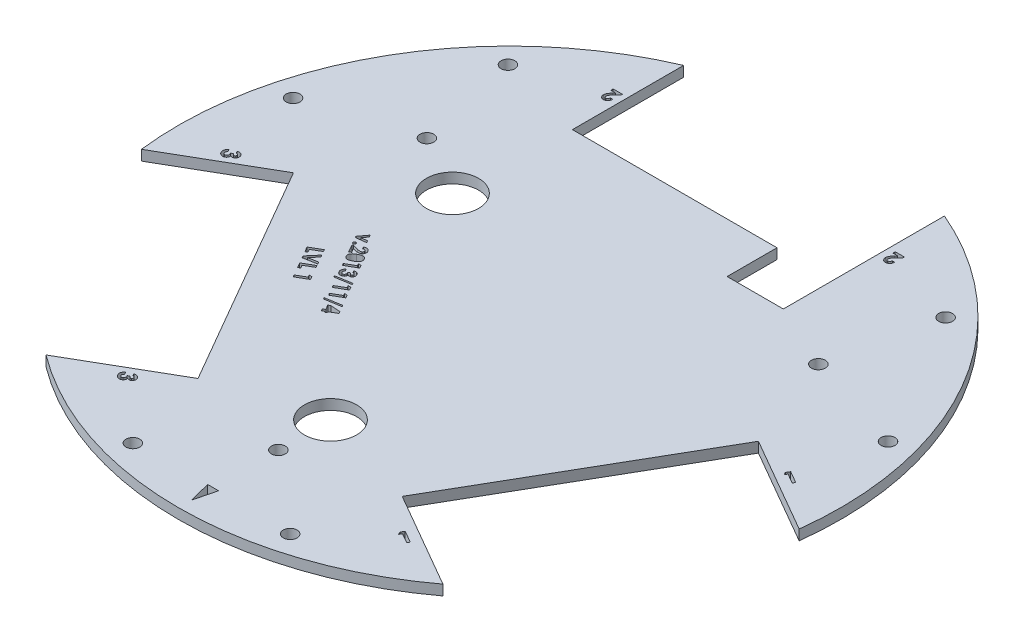
from build123d import *

# Parameters (mm, degrees)
BOSS_EXTRUDE1_DEPTH            = 2.3622
SKETCH2_R                      = 1.59
STRUCTURE_MOUNTING_HOLES_DEPTH = 10
SKETCH4_R                      = 6
SKETCH4_R_2                    = 5.999999938
CABLE_HOLES_DEPTH              = 10
SKETCH8_W                      = 12.929724252
SKETCH8_H                      = 12.570939697
CUT_EXTRUDE6_DEPTH             = 2.54
CUT_EXTRUDE7_DEPTH             = 10


with BuildPart() as part:
    # Sketch1 → Boss-Extrude1 (new body)
    with BuildSketch(Plane(origin=(0, 0, 0), x_dir=(1, 0, 0), z_dir=(0, 1, 0))):
        with BuildLine():
            Line((-30, 70.045984896), (-30, 44.445984896))
            Line((-30, 44.445984896), (30, 44.445984896))
            Line((30, 44.445984896), (30, 70.045984896))
            ThreePointArc((30, 70.045984896), (65.991135768, 38.1), (75.661602353, -9.042230334))
            Line((75.661602353, -9.042230334), (53.491352016, 3.757769666))
            Line((53.491352016, 3.757769666), (23.491352016, -48.203754561))
            Line((23.491352016, -48.203754561), (45.661602353, -61.003754561))
            ThreePointArc((45.661602353, -61.003754561), (0, -76.2), (-45.661602353, -61.003754561))
            Line((-45.661602353, -61.003754561), (-23.491352016, -48.203754561))
            Line((-23.491352016, -48.203754561), (-53.491352016, 3.757769666))
            Line((-53.491352016, 3.757769666), (-75.661602353, -9.042230333))
            ThreePointArc((-75.661602353, -9.042230333), (-65.991135768, 38.1), (-30, 70.045984896))
        make_face()
        Polygon((30.339963763, -55.594499543), (30.792172296, -54.811561842), (33.540404468, -56.399061842), (33.240204147, -56.918688245), (30.982977585, -55.614852107), (30.656064524, -56.180907796), align=None, mode=Mode.SUBTRACT)
        Polygon((62.802624019, 0.63247737), (63.254832553, 1.415415071), (66.003064724, -0.172084929), (65.702864404, -0.691711332), (63.445637841, 0.612124806), (63.11872478, 0.046069117), align=None, mode=Mode.SUBTRACT)
        with BuildLine():
            Line((32.930769231, 55.129318229), (33.500641026, 55.129318229))
            add(Edge.make_bspline(
                [(33.500641026, 55.129318229), (33.498180803, 55.086209991), (33.493373676, 55.001979084), (33.474231165, 54.879638558), (33.448646767, 54.764011929), (33.414209536, 54.655446816), (33.371792359, 54.553897607), (33.320339524, 54.459700679), (33.261387227, 54.372181067), (33.193747175, 54.292873689), (33.12016455, 54.221573945), (33.040827993, 54.159241837), (32.95596287, 54.10706171), (32.866136655, 54.064258115), (32.771702175, 54.030009725), (32.671705302, 54.00712396), (32.567028379, 53.991622143), (32.495367913, 53.990265891), (32.458844151, 53.989574639)],
                knots=[0, 0, 0, 0, 1.198928049, 2.342633425, 3.435730849, 4.486331048, 5.502589352, 6.488331875, 7.46361919, 8.428949135, 9.378681775, 10.305958057, 11.226249248, 12.140413166, 13.066341608, 14.010670971, 14.986082777, 16, 16, 16, 16], degree=3))
            add(Edge.make_bspline(
                [(32.458844151, 53.989574639), (32.413992606, 53.990881783), (32.326393407, 53.993434754), (32.199511317, 54.018015164), (32.080257487, 54.055878636), (31.96981038, 54.110337114), (31.868748868, 54.179322953), (31.778274355, 54.262459761), (31.697971611, 54.358727753), (31.630487936, 54.467423303), (31.575599258, 54.582922009), (31.535968383, 54.701653921), (31.510227483, 54.821225079), (31.507463063, 54.901709624), (31.506089744, 54.941693029)],
                knots=[0, 0, 0, 0, 1.075206757, 2.099977874, 3.089436832, 4.070080219, 5.043757236, 6.01602434, 7.009399377, 8.042659726, 9.078134622, 10.07077983, 11.041594984, 12, 12, 12, 12], degree=3))
            add(Edge.make_bspline(
                [(31.506089744, 54.941693029), (31.506622416, 54.965879219), (31.507694554, 55.014560045), (31.515149274, 55.088226084), (31.526332825, 55.163263558), (31.5431949, 55.239608124), (31.564223269, 55.317281202), (31.589733801, 55.396515173), (31.620317852, 55.476861072), (31.655466548, 55.55922214), (31.697393965, 55.643869936), (31.74623345, 55.732056186), (31.803332638, 55.824023554), (31.868134073, 55.919485709), (31.940181278, 56.019182984), (32.020570888, 56.12193462), (32.108273307, 56.228900672), (32.170538688, 56.300387568), (32.202529046, 56.337115705)],
                knots=[0, 0, 0, 0, 0.728286467, 1.465860763, 2.227952348, 3.011875114, 3.818782069, 4.650637576, 5.517456182, 6.406927181, 7.346324104, 8.360844784, 9.441645378, 10.605053135, 11.834886952, 13.145197974, 14.533275831, 16, 16, 16, 16], degree=3))
            Line((32.202529046, 56.337115705), (32.533894231, 56.716818229))
            Line((32.533894231, 56.716818229), (31.465384615, 56.716818229))
            Line((31.465384615, 56.716818229), (31.465384615, 57.245984896))
            Line((31.465384615, 57.245984896), (33.582051282, 57.245984896))
            Line((33.582051282, 57.245984896), (33.582051282, 56.957232892))
            Line((33.582051282, 56.957232892), (32.642017228, 55.956777163))
            add(Edge.make_bspline(
                [(32.642017228, 55.956777163), (32.614800395, 55.927593849), (32.562089462, 55.871074425), (32.487094235, 55.788064895), (32.419205204, 55.709307835), (32.359940358, 55.633889925), (32.305714004, 55.564364718), (32.26034967, 55.498103893), (32.220842893, 55.436973473), (32.179573891, 55.362457924), (32.139479964, 55.274256105), (32.102714472, 55.172706796), (32.08052801, 55.075580983), (32.077441998, 55.012178409), (32.075961538, 54.981762139)],
                knots=[0, 0, 0, 0, 1.246192343, 2.413505005, 3.49357156, 4.492416076, 5.408771964, 6.246246772, 6.999304986, 7.680960093, 8.904522682, 10.020616941, 11.0504258, 12, 12, 12, 12], degree=3))
            add(Edge.make_bspline(
                [(32.075961538, 54.981762139), (32.077048282, 54.952326939), (32.079154023, 54.895291518), (32.102871209, 54.814394976), (32.138357979, 54.740595595), (32.189878041, 54.677255139), (32.252061438, 54.624751793), (32.324328879, 54.586277975), (32.405353477, 54.563665088), (32.462092569, 54.560879456), (32.49128105, 54.559446434)],
                knots=[0, 0, 0, 0, 1.061596218, 2.057012874, 3.024113775, 4.006148568, 4.986025304, 5.949989669, 6.945406325, 8, 8, 8, 8], degree=3))
            add(Edge.make_bspline(
                [(32.49128105, 54.559446434), (32.506357217, 54.559979671), (32.536037073, 54.561029432), (32.579664142, 54.568017412), (32.621178433, 54.580332998), (32.661042022, 54.596834149), (32.698829475, 54.618706543), (32.73444548, 54.645667753), (32.768265297, 54.677032634), (32.800133814, 54.712703112), (32.829138325, 54.752511376), (32.854900026, 54.796093858), (32.876200664, 54.843423507), (32.894954519, 54.893875497), (32.90941839, 54.947991726), (32.919949882, 55.005448312), (32.927956273, 55.066151783), (32.92981452, 55.107879711), (32.930769231, 55.129318229)],
                knots=[0, 0, 0, 0, 0.903469896, 1.778625579, 2.63899355, 3.493148037, 4.358286772, 5.247621495, 6.164656832, 7.118446693, 8.109501108, 9.111810964, 10.146451449, 11.215617525, 12.33435995, 13.498009769, 14.714554818, 16, 16, 16, 16], degree=3))
        make_face(mode=Mode.SUBTRACT)
        with BuildLine():
            Line((-31.953846154, 55.129318229), (-31.383974359, 55.129318229))
            add(Edge.make_bspline(
                [(-31.383974359, 55.129318229), (-31.386434582, 55.086209991), (-31.391241709, 55.001979084), (-31.410384219, 54.879638558), (-31.435968617, 54.764011929), (-31.470405849, 54.655446816), (-31.512823025, 54.553897607), (-31.564275861, 54.459700679), (-31.623228158, 54.372181067), (-31.69086821, 54.292873689), (-31.764450834, 54.221573945), (-31.843787391, 54.159241837), (-31.928652514, 54.10706171), (-32.018478729, 54.064258115), (-32.11291321, 54.030009725), (-32.212910083, 54.00712396), (-32.317587006, 53.991622143), (-32.389247472, 53.990265891), (-32.425771234, 53.989574639)],
                knots=[0, 0, 0, 0, 1.198928049, 2.342633425, 3.435730849, 4.486331048, 5.502589352, 6.488331875, 7.46361919, 8.428949135, 9.378681775, 10.305958057, 11.226249248, 12.140413166, 13.066341608, 14.010670971, 14.986082777, 16, 16, 16, 16], degree=3))
            add(Edge.make_bspline(
                [(-32.425771234, 53.989574639), (-32.470622778, 53.990881783), (-32.558221977, 53.993434754), (-32.685104068, 54.018015164), (-32.804357897, 54.055878636), (-32.914805005, 54.110337114), (-33.015866517, 54.179322953), (-33.106341029, 54.262459761), (-33.186643774, 54.358727753), (-33.254127448, 54.467423303), (-33.309016126, 54.582922009), (-33.348647002, 54.701653921), (-33.374387901, 54.821225079), (-33.377152322, 54.901709624), (-33.378525641, 54.941693029)],
                knots=[0, 0, 0, 0, 1.075206757, 2.099977874, 3.089436832, 4.070080219, 5.043757236, 6.01602434, 7.009399377, 8.042659726, 9.078134622, 10.07077983, 11.041594984, 12, 12, 12, 12], degree=3))
            add(Edge.make_bspline(
                [(-33.378525641, 54.941693029), (-33.377992969, 54.965879219), (-33.37692083, 55.014560045), (-33.369466111, 55.088226084), (-33.35828256, 55.163263558), (-33.341420485, 55.239608124), (-33.320392116, 55.317281202), (-33.294881584, 55.396515173), (-33.264297533, 55.476861072), (-33.229148837, 55.55922214), (-33.18722142, 55.643869936), (-33.138381934, 55.732056186), (-33.081282746, 55.824023554), (-33.016481311, 55.919485709), (-32.944434107, 56.019182984), (-32.864044496, 56.12193462), (-32.776342077, 56.228900672), (-32.714076696, 56.300387568), (-32.682086338, 56.337115705)],
                knots=[0, 0, 0, 0, 0.728286467, 1.465860763, 2.227952348, 3.011875114, 3.818782069, 4.650637576, 5.517456182, 6.406927181, 7.346324104, 8.360844784, 9.441645378, 10.605053135, 11.834886952, 13.145197974, 14.533275831, 16, 16, 16, 16], degree=3))
            Line((-32.682086338, 56.337115705), (-32.350721154, 56.716818229))
            Line((-32.350721154, 56.716818229), (-33.419230769, 56.716818229))
            Line((-33.419230769, 56.716818229), (-33.419230769, 57.245984896))
            Line((-33.419230769, 57.245984896), (-31.302564103, 57.245984896))
            Line((-31.302564103, 57.245984896), (-31.302564103, 56.957232892))
            Line((-31.302564103, 56.957232892), (-32.242598157, 55.956777163))
            add(Edge.make_bspline(
                [(-32.242598157, 55.956777163), (-32.26981499, 55.927593849), (-32.322525923, 55.871074425), (-32.39752115, 55.788064895), (-32.46541018, 55.709307835), (-32.524675027, 55.633889925), (-32.578901381, 55.564364718), (-32.624265715, 55.498103893), (-32.663772492, 55.436973473), (-32.705041493, 55.362457924), (-32.745135421, 55.274256105), (-32.781900912, 55.172706796), (-32.804087375, 55.075580983), (-32.807173386, 55.012178409), (-32.808653846, 54.981762139)],
                knots=[0, 0, 0, 0, 1.246192343, 2.413505005, 3.49357156, 4.492416076, 5.408771964, 6.246246772, 6.999304986, 7.680960093, 8.904522682, 10.020616941, 11.0504258, 12, 12, 12, 12], degree=3))
            add(Edge.make_bspline(
                [(-32.808653846, 54.981762139), (-32.807567102, 54.952326939), (-32.805461362, 54.895291518), (-32.781744176, 54.814394976), (-32.746257406, 54.740595595), (-32.694737344, 54.677255139), (-32.632553947, 54.624751793), (-32.560286506, 54.586277975), (-32.479261907, 54.563665088), (-32.422522816, 54.560879456), (-32.393334335, 54.559446434)],
                knots=[0, 0, 0, 0, 1.061596218, 2.057012874, 3.024113775, 4.006148568, 4.986025304, 5.949989669, 6.945406325, 8, 8, 8, 8], degree=3))
            add(Edge.make_bspline(
                [(-32.393334335, 54.559446434), (-32.378258168, 54.559979671), (-32.348578311, 54.561029432), (-32.304951242, 54.568017412), (-32.263436952, 54.580332998), (-32.223573363, 54.596834149), (-32.18578591, 54.618706543), (-32.150169904, 54.645667753), (-32.116350088, 54.677032634), (-32.08448157, 54.712703112), (-32.055477059, 54.752511376), (-32.029715359, 54.796093858), (-32.008414721, 54.843423507), (-31.989660865, 54.893875497), (-31.975196995, 54.947991726), (-31.964665502, 55.005448312), (-31.956659112, 55.066151783), (-31.954800864, 55.107879711), (-31.953846154, 55.129318229)],
                knots=[0, 0, 0, 0, 0.903469896, 1.778625579, 2.63899355, 3.493148037, 4.358286772, 5.247621495, 6.164656832, 7.118446693, 8.109501108, 9.111810964, 10.146451449, 11.215617525, 12.33435995, 13.498009769, 14.714554818, 16, 16, 16, 16], degree=3))
        make_face(mode=Mode.SUBTRACT)
        with BuildLine():
            Line((-63.938551503, 1.034417091), (-64.228575542, 1.536871017))
            add(Edge.make_bspline(
                [(-64.228575542, 1.536871017), (-64.201587372, 1.547671821), (-64.148873225, 1.568768293), (-64.068619382, 1.592919176), (-63.989779442, 1.610875617), (-63.911960468, 1.622358267), (-63.835373258, 1.627816539), (-63.760061495, 1.625567172), (-63.685829192, 1.617911876), (-63.637625071, 1.606706184), (-63.613546495, 1.601108798)],
                knots=[0, 0, 0, 0, 1.107901622, 2.163988478, 3.191569978, 4.188424195, 5.1605888, 6.114741573, 7.058289259, 8, 8, 8, 8], degree=3))
            add(Edge.make_bspline(
                [(-63.613546495, 1.601108798), (-63.580685093, 1.59178876), (-63.515796797, 1.573385364), (-63.423005173, 1.534814288), (-63.336218701, 1.487454885), (-63.254798519, 1.4321293), (-63.180016897, 1.366964131), (-63.110399596, 1.29380926), (-63.047211086, 1.211140699), (-63.010309052, 1.151354312), (-62.991521255, 1.120915488)],
                knots=[0, 0, 0, 0, 1.013465039, 2.001193364, 2.975737525, 3.944696158, 4.917572099, 5.914900419, 6.938420904, 8, 8, 8, 8], degree=3))
            add(Edge.make_bspline(
                [(-62.991521255, 1.120915488), (-62.976131484, 1.09298898), (-62.945870633, 1.038077185), (-62.910528901, 0.952201554), (-62.882706812, 0.866181666), (-62.86418714, 0.77943501), (-62.854720493, 0.692284705), (-62.853256132, 0.604733921), (-62.861052715, 0.516524534), (-62.877521258, 0.429050992), (-62.901668477, 0.344219822), (-62.931911319, 0.264010521), (-62.96893949, 0.189453), (-63.013292408, 0.1209374), (-63.063999222, 0.05777139), (-63.122115965, 0.001044706), (-63.1855157, -0.051400505), (-63.232812812, -0.080030283), (-63.256740606, -0.094514199)],
                knots=[0, 0, 0, 0, 1.105385769, 2.173516099, 3.215551147, 4.238278602, 5.244584198, 6.252286397, 7.271065952, 8.311100557, 9.335492682, 10.327151563, 11.28099778, 12.21738801, 13.153518256, 14.084433573, 15.030907478, 16, 16, 16, 16], degree=3))
            add(Edge.make_bspline(
                [(-63.256740606, -0.094514199), (-63.287489641, -0.110517657), (-63.348083086, -0.142053756), (-63.445859413, -0.172620253), (-63.546553177, -0.188643837), (-63.65003642, -0.189816845), (-63.75493446, -0.175908366), (-63.85904215, -0.145091009), (-63.963094485, -0.100463208), (-64.028308387, -0.059611634), (-64.061938923, -0.038544648)],
                knots=[0, 0, 0, 0, 0.974404531, 1.920142448, 2.86905825, 3.836085688, 4.823745563, 5.836306088, 6.884192119, 8, 8, 8, 8], degree=3))
            add(Edge.make_bspline(
                [(-64.061938923, -0.038544648), (-64.05674391, -0.062652424), (-64.046501164, -0.110184518), (-64.036842879, -0.181604286), (-64.033265781, -0.251554226), (-64.033944202, -0.32031594), (-64.042223883, -0.387402734), (-64.053877472, -0.453477848), (-64.071925026, -0.517932779), (-64.095295493, -0.580728943), (-64.124176865, -0.640818992), (-64.156293948, -0.698909242), (-64.194958281, -0.752494359), (-64.236883799, -0.804034916), (-64.284021431, -0.851401323), (-64.335589608, -0.895964032), (-64.391896443, -0.937012601), (-64.432138273, -0.96167576), (-64.452453747, -0.974126579)],
                knots=[0, 0, 0, 0, 1.082911052, 2.135121458, 3.160919659, 4.157434519, 5.150768472, 6.126044305, 7.10198669, 8.086112758, 9.064938288, 10.028182329, 10.996991188, 11.962707453, 12.943789211, 13.927518729, 14.953739469, 16, 16, 16, 16], degree=3))
            add(Edge.make_bspline(
                [(-64.452453747, -0.974126579), (-64.483305701, -0.990881157), (-64.543861651, -1.023766899), (-64.638999493, -1.061518454), (-64.735430267, -1.088295699), (-64.833460372, -1.104904657), (-64.932824849, -1.111669716), (-65.033645701, -1.105975485), (-65.135630524, -1.090620867), (-65.238125544, -1.065320866), (-65.338616403, -1.030128013), (-65.434723597, -0.984647161), (-65.525250421, -0.929534702), (-65.611062181, -0.865886579), (-65.69062077, -0.792020908), (-65.765428151, -0.709726198), (-65.834526609, -0.61764073), (-65.874940518, -0.550907172), (-65.895577745, -0.516829904)],
                knots=[0, 0, 0, 0, 0.995956168, 1.954854222, 2.898137721, 3.832159877, 4.772963349, 5.719084143, 6.69280729, 7.697075385, 8.711624244, 9.71041314, 10.7095465, 11.715832357, 12.738081516, 13.786223357, 14.869542352, 16, 16, 16, 16], degree=3))
            add(Edge.make_bspline(
                [(-65.895577745, -0.516829904), (-65.913815387, -0.483860395), (-65.949448334, -0.419444133), (-65.991120422, -0.319237267), (-66.024422507, -0.219970296), (-66.045668382, -0.120076651), (-66.058458478, -0.020688469), (-66.059158046, 0.078645605), (-66.051429307, 0.177621806), (-66.031776474, 0.275496105), (-66.003667387, 0.371658691), (-65.964417641, 0.463906531), (-65.9164019, 0.552741149), (-65.858251104, 0.637020693), (-65.791265503, 0.718019126), (-65.713300314, 0.793237595), (-65.627707225, 0.866763298), (-65.564242475, 0.909933546), (-65.531775662, 0.932018253)],
                knots=[0, 0, 0, 0, 1.0828852, 2.115755418, 3.116538504, 4.090108764, 5.048377776, 5.993598408, 6.942058762, 7.898755042, 8.859523462, 9.818742628, 10.776468272, 11.759123839, 12.759237952, 13.794086196, 14.871515413, 16, 16, 16, 16], degree=3))
            Line((-65.531775662, 0.932018253), (-65.232211359, 0.414299903))
            add(Edge.make_bspline(
                [(-65.232211359, 0.414299903), (-65.247635397, 0.401336064), (-65.277753782, 0.376021689), (-65.319115217, 0.335995193), (-65.355607395, 0.295282191), (-65.386908783, 0.253666864), (-65.413651535, 0.211867104), (-65.435868855, 0.16947068), (-65.45205006, 0.126173912), (-65.468575483, 0.068791478), (-65.475826341, -0.004780943), (-65.468997093, -0.093684201), (-65.443677383, -0.182918093), (-65.414528717, -0.238713096), (-65.399483995, -0.267510994)],
                knots=[0, 0, 0, 0, 0.934463678, 1.824719104, 2.667592896, 3.468150092, 4.237532693, 4.967698102, 5.683684191, 6.378067433, 7.733490483, 9.085197688, 10.495561016, 12, 12, 12, 12], degree=3))
            add(Edge.make_bspline(
                [(-65.399483995, -0.267510994), (-65.390388631, -0.282290947), (-65.372646271, -0.311122255), (-65.34247902, -0.351197272), (-65.309217249, -0.386490098), (-65.274334311, -0.419043364), (-65.235808389, -0.44594609), (-65.195582374, -0.470212135), (-65.152145887, -0.488800305), (-65.092447123, -0.509343678), (-65.015578934, -0.522857358), (-64.923256568, -0.521274564), (-64.832493141, -0.500186747), (-64.777165253, -0.471653148), (-64.748837962, -0.457044247)],
                knots=[0, 0, 0, 0, 0.825498595, 1.61030317, 2.381175776, 3.130970414, 3.875590236, 4.612586818, 5.362313599, 6.118325097, 7.614245731, 9.046966094, 10.488077951, 12, 12, 12, 12], degree=3))
            add(Edge.make_bspline(
                [(-64.748837962, -0.457044247), (-64.733726775, -0.447895522), (-64.703921489, -0.429850586), (-64.664411968, -0.396317436), (-64.629675486, -0.358776724), (-64.598851712, -0.317797076), (-64.57433899, -0.271718189), (-64.552964431, -0.22280368), (-64.53708542, -0.169411897), (-64.526560905, -0.112271832), (-64.520634936, -0.05183556), (-64.521270813, 0.011297036), (-64.529262012, 0.076423715), (-64.543455572, 0.143617951), (-64.564080157, 0.213069472), (-64.590736484, 0.2850336), (-64.624795798, 0.358976166), (-64.651252898, 0.408081364), (-64.664883635, 0.433380432)],
                knots=[0, 0, 0, 0, 0.848676311, 1.673928198, 2.482115482, 3.306169204, 4.132302839, 4.986658837, 5.870690431, 6.804777346, 7.777963707, 8.78765716, 9.835068452, 10.929153256, 12.087693689, 13.317140735, 14.61778708, 16, 16, 16, 16], degree=3))
            Line((-64.664883635, 0.433380432), (-64.216491207, 0.692239607))
            add(Edge.make_bspline(
                [(-64.216491207, 0.692239607), (-64.197022399, 0.664115885), (-64.16057838, 0.611470576), (-64.102762504, 0.542898775), (-64.050155825, 0.486487525), (-63.998526401, 0.444577074), (-63.948153157, 0.41318027), (-63.896861536, 0.392278816), (-63.845391875, 0.375735183), (-63.792671945, 0.369446482), (-63.740939017, 0.369127088), (-63.690931622, 0.37610695), (-63.643693104, 0.390629801), (-63.614627779, 0.405594457), (-63.600190125, 0.413027868)],
                knots=[0, 0, 0, 0, 1.636125233, 3.062692806, 4.28985753, 5.321554568, 6.236960596, 7.119026226, 7.96656224, 8.816161126, 9.648248204, 10.437530957, 11.223872881, 12, 12, 12, 12], degree=3))
            add(Edge.make_bspline(
                [(-63.600190125, 0.413027868), (-63.582738543, 0.424473485), (-63.548825673, 0.446715235), (-63.50682441, 0.490388304), (-63.476731875, 0.541795514), (-63.456962282, 0.598793639), (-63.448285937, 0.659868022), (-63.454241849, 0.722698225), (-63.47123219, 0.786477288), (-63.49247433, 0.826163844), (-63.503515446, 0.846791891)],
                knots=[0, 0, 0, 0, 1.003706715, 1.950457832, 2.889735573, 3.852723985, 4.842604589, 5.837115255, 6.875788371, 8, 8, 8, 8], degree=3))
            add(Edge.make_bspline(
                [(-63.503515446, 0.846791891), (-63.514964924, 0.864882646), (-63.537511751, 0.900507774), (-63.582208603, 0.945118497), (-63.632077279, 0.983800782), (-63.689478297, 1.012089652), (-63.749840273, 1.033493881), (-63.812351684, 1.044058581), (-63.875819022, 1.046230243), (-63.917424899, 1.038395441), (-63.938551503, 1.034417091)],
                knots=[0, 0, 0, 0, 1.011574127, 1.992037248, 2.974608507, 3.990066615, 5.009938377, 5.999317311, 6.984094696, 8, 8, 8, 8], degree=3))
        make_face(mode=Mode.SUBTRACT)
        with BuildLine():
            Line((-31.475891247, -55.192559822), (-31.765915285, -54.690105896))
            add(Edge.make_bspline(
                [(-31.765915285, -54.690105896), (-31.738927115, -54.679305092), (-31.686212969, -54.65820862), (-31.605959126, -54.634057737), (-31.527119185, -54.616101296), (-31.449300212, -54.604618646), (-31.372713002, -54.599160374), (-31.297401239, -54.60140974), (-31.223168935, -54.609065037), (-31.174964815, -54.620270729), (-31.150886239, -54.625868115)],
                knots=[0, 0, 0, 0, 1.107901622, 2.163988478, 3.191569978, 4.188424195, 5.1605888, 6.114741573, 7.058289259, 8, 8, 8, 8], degree=3))
            add(Edge.make_bspline(
                [(-31.150886239, -54.625868115), (-31.118024837, -54.635188153), (-31.05313654, -54.653591549), (-30.960344917, -54.692162625), (-30.873558445, -54.739522028), (-30.792138263, -54.794847613), (-30.717356641, -54.860012781), (-30.64773934, -54.933167653), (-30.584550829, -55.015836214), (-30.547648795, -55.075622601), (-30.528860998, -55.106061425)],
                knots=[0, 0, 0, 0, 1.013465039, 2.001193364, 2.975737525, 3.944696158, 4.917572099, 5.914900419, 6.938420904, 8, 8, 8, 8], degree=3))
            add(Edge.make_bspline(
                [(-30.528860998, -55.106061425), (-30.513471228, -55.133987933), (-30.483210376, -55.188899728), (-30.447868645, -55.274775359), (-30.420046556, -55.360795247), (-30.401526883, -55.447541903), (-30.392060236, -55.534692208), (-30.390595875, -55.622242992), (-30.398392459, -55.710452378), (-30.414861002, -55.797925921), (-30.439008221, -55.882757091), (-30.469251063, -55.962966392), (-30.506279234, -56.037523913), (-30.550632152, -56.106039513), (-30.601338966, -56.169205523), (-30.659455709, -56.225932207), (-30.722855443, -56.278377418), (-30.770152556, -56.307007196), (-30.794080349, -56.321491112)],
                knots=[0, 0, 0, 0, 1.105385769, 2.173516099, 3.215551147, 4.238278602, 5.244584198, 6.252286397, 7.271065952, 8.311100557, 9.335492682, 10.327151563, 11.28099778, 12.21738801, 13.153518256, 14.084433573, 15.030907478, 16, 16, 16, 16], degree=3))
            add(Edge.make_bspline(
                [(-30.794080349, -56.321491112), (-30.824829385, -56.33749457), (-30.88542283, -56.369030669), (-30.983199157, -56.399597166), (-31.08389292, -56.41562075), (-31.187376164, -56.416793758), (-31.292274204, -56.402885279), (-31.396381894, -56.372067922), (-31.500434228, -56.327440121), (-31.565648131, -56.286588547), (-31.599278667, -56.265521561)],
                knots=[0, 0, 0, 0, 0.974404531, 1.920142448, 2.86905825, 3.836085688, 4.823745563, 5.836306088, 6.884192119, 8, 8, 8, 8], degree=3))
            add(Edge.make_bspline(
                [(-31.599278667, -56.265521561), (-31.594083654, -56.289629337), (-31.583840907, -56.337161431), (-31.574182622, -56.408581199), (-31.570605524, -56.478531139), (-31.571283946, -56.547292853), (-31.579563627, -56.614379647), (-31.591217216, -56.680454761), (-31.60926477, -56.744909692), (-31.632635237, -56.807705856), (-31.661516609, -56.867795905), (-31.693633692, -56.925886155), (-31.732298025, -56.979471272), (-31.774223543, -57.031011828), (-31.821361175, -57.078378236), (-31.872929352, -57.122940944), (-31.929236187, -57.163989514), (-31.969478017, -57.188652673), (-31.98979349, -57.201103492)],
                knots=[0, 0, 0, 0, 1.082911052, 2.135121458, 3.160919659, 4.157434519, 5.150768472, 6.126044305, 7.10198669, 8.086112758, 9.064938288, 10.028182329, 10.996991188, 11.962707453, 12.943789211, 13.927518729, 14.953739469, 16, 16, 16, 16], degree=3))
            add(Edge.make_bspline(
                [(-31.98979349, -57.201103492), (-32.020645444, -57.21785807), (-32.081201394, -57.250743812), (-32.176339236, -57.288495367), (-32.27277001, -57.315272612), (-32.370800115, -57.33188157), (-32.470164593, -57.338646629), (-32.570985445, -57.332952398), (-32.672970267, -57.31759778), (-32.775465288, -57.292297779), (-32.875956146, -57.257104926), (-32.972063341, -57.211624074), (-33.062590164, -57.156511615), (-33.148401924, -57.092863492), (-33.227960514, -57.018997821), (-33.302767894, -56.936703111), (-33.371866352, -56.844617643), (-33.412280261, -56.777884085), (-33.432917489, -56.743806817)],
                knots=[0, 0, 0, 0, 0.995956168, 1.954854222, 2.898137721, 3.832159877, 4.772963349, 5.719084143, 6.69280729, 7.697075385, 8.711624244, 9.71041314, 10.7095465, 11.715832357, 12.738081516, 13.786223357, 14.869542352, 16, 16, 16, 16], degree=3))
            add(Edge.make_bspline(
                [(-33.432917489, -56.743806817), (-33.451155131, -56.710837308), (-33.486788077, -56.646421046), (-33.528460165, -56.54621418), (-33.56176225, -56.446947209), (-33.583008126, -56.347053564), (-33.595798221, -56.247665382), (-33.59649779, -56.148331308), (-33.588769051, -56.049355107), (-33.569116218, -55.951480808), (-33.54100713, -55.855318222), (-33.501757385, -55.763070382), (-33.453741643, -55.674235763), (-33.395590848, -55.58995622), (-33.328605247, -55.508957787), (-33.250640058, -55.433739318), (-33.165046968, -55.360213615), (-33.101582219, -55.317043367), (-33.069115405, -55.29495866)],
                knots=[0, 0, 0, 0, 1.0828852, 2.115755418, 3.116538504, 4.090108764, 5.048377776, 5.993598408, 6.942058762, 7.898755042, 8.859523462, 9.818742628, 10.776468272, 11.759123839, 12.759237952, 13.794086196, 14.871515413, 16, 16, 16, 16], degree=3))
            Line((-33.069115405, -55.29495866), (-32.769551103, -55.81267701))
            add(Edge.make_bspline(
                [(-32.769551103, -55.81267701), (-32.784975141, -55.825640849), (-32.815093525, -55.850955224), (-32.856454961, -55.89098172), (-32.892947138, -55.931694722), (-32.924248526, -55.973310049), (-32.950991278, -56.015109809), (-32.973208598, -56.057506232), (-32.989389804, -56.100803001), (-33.005915226, -56.158185434), (-33.013166085, -56.231757856), (-33.006336836, -56.320661114), (-32.981017127, -56.409895006), (-32.951868461, -56.465690009), (-32.936823739, -56.494487907)],
                knots=[0, 0, 0, 0, 0.934463678, 1.824719104, 2.667592896, 3.468150092, 4.237532693, 4.967698102, 5.683684191, 6.378067433, 7.733490483, 9.085197688, 10.495561016, 12, 12, 12, 12], degree=3))
            add(Edge.make_bspline(
                [(-32.936823739, -56.494487907), (-32.927728375, -56.50926786), (-32.909986014, -56.538099168), (-32.879818763, -56.578174185), (-32.846556992, -56.613467011), (-32.811674055, -56.646020277), (-32.773148132, -56.672923003), (-32.732922118, -56.697189048), (-32.68948563, -56.715777218), (-32.629786866, -56.736320591), (-32.552918677, -56.749834271), (-32.460596312, -56.748251477), (-32.369832884, -56.72716366), (-32.314504997, -56.698630061), (-32.286177705, -56.68402116)],
                knots=[0, 0, 0, 0, 0.825498595, 1.61030317, 2.381175776, 3.130970414, 3.875590236, 4.612586818, 5.362313599, 6.118325097, 7.614245731, 9.046966094, 10.488077951, 12, 12, 12, 12], degree=3))
            add(Edge.make_bspline(
                [(-32.286177705, -56.68402116), (-32.271066519, -56.674872435), (-32.241261232, -56.656827499), (-32.201751712, -56.623294349), (-32.16701523, -56.585753637), (-32.136191456, -56.544773989), (-32.111678734, -56.498695102), (-32.090304174, -56.449780593), (-32.074425164, -56.39638881), (-32.063900649, -56.339248745), (-32.05797468, -56.278812473), (-32.058610556, -56.215679877), (-32.066601756, -56.150553198), (-32.080795316, -56.083358962), (-32.101419901, -56.013907441), (-32.128076228, -55.941943313), (-32.162135541, -55.868000747), (-32.188592642, -55.818895549), (-32.202223378, -55.793596481)],
                knots=[0, 0, 0, 0, 0.848676311, 1.673928198, 2.482115482, 3.306169204, 4.132302839, 4.986658837, 5.870690431, 6.804777346, 7.777963707, 8.78765716, 9.835068452, 10.929153256, 12.087693689, 13.317140735, 14.61778708, 16, 16, 16, 16], degree=3))
            Line((-32.202223378, -55.793596481), (-31.75383095, -55.534737306))
            add(Edge.make_bspline(
                [(-31.75383095, -55.534737306), (-31.734362142, -55.562861028), (-31.697918123, -55.615506337), (-31.640102248, -55.684078138), (-31.587495569, -55.740489388), (-31.535866145, -55.782399839), (-31.485492901, -55.813796643), (-31.434201279, -55.834698097), (-31.382731618, -55.85124173), (-31.330011689, -55.857530431), (-31.27827876, -55.857849825), (-31.228271366, -55.850869963), (-31.181032847, -55.836347112), (-31.151967522, -55.821382456), (-31.137529869, -55.813949045)],
                knots=[0, 0, 0, 0, 1.636125233, 3.062692806, 4.28985753, 5.321554568, 6.236960596, 7.119026226, 7.96656224, 8.816161126, 9.648248204, 10.437530957, 11.223872881, 12, 12, 12, 12], degree=3))
            add(Edge.make_bspline(
                [(-31.137529869, -55.813949045), (-31.120078286, -55.802503428), (-31.086165417, -55.780261678), (-31.044164154, -55.736588609), (-31.014071618, -55.685181399), (-30.994302026, -55.628183274), (-30.985625681, -55.567108891), (-30.991581593, -55.504278688), (-31.008571934, -55.440499625), (-31.029814074, -55.400813069), (-31.040855189, -55.380185022)],
                knots=[0, 0, 0, 0, 1.003706715, 1.950457832, 2.889735573, 3.852723985, 4.842604589, 5.837115255, 6.875788371, 8, 8, 8, 8], degree=3))
            add(Edge.make_bspline(
                [(-31.040855189, -55.380185022), (-31.052304667, -55.362094267), (-31.074851494, -55.326469139), (-31.119548346, -55.281858416), (-31.169417023, -55.243176131), (-31.226818041, -55.21488726), (-31.287180017, -55.193483032), (-31.349691427, -55.182918331), (-31.413158766, -55.18074667), (-31.454764643, -55.188581472), (-31.475891247, -55.192559822)],
                knots=[0, 0, 0, 0, 1.011574127, 1.992037248, 2.974608507, 3.990066615, 5.009938377, 5.999317311, 6.984094696, 8, 8, 8, 8], degree=3))
        make_face(mode=Mode.SUBTRACT)
    extrude(amount=BOSS_EXTRUDE1_DEPTH)

    # Sketch2 → Structure Mounting Holes (cut)
    with BuildSketch(Plane(origin=(0, 2.3622, 0), x_dir=(1, 0, 0), z_dir=(0, 1, 0))):
        with Locations(Location((18.1, -68.58, 0), (0, 0, 270))):
            Circle(SKETCH2_R)
        with Locations(Location((-50.342022192, 49.965059808, 0), (0, 0, 270))):
            Circle(SKETCH2_R)
        with Locations(Location((-18.1, -68.58, 0), (0, 0, 270))):
            Circle(SKETCH2_R)
        with Locations(Location((-68.442022192, 18.614940192, 0), (0, 0, 270))):
            Circle(SKETCH2_R)
        with Locations(Location((68.442022192, 18.614940192, 0), (0, 0, 270))):
            Circle(SKETCH2_R)
        with Locations(Location((50.342022192, 49.965059808, 0), (0, 0, 270))):
            Circle(SKETCH2_R)
        with Locations(Location((45.033320996, 26.000000001, 0), (0, 0, 270))):
            Circle(SKETCH2_R)
        with Locations(Location((0, -53.21, 0), (0, 0, 270))):
            Circle(SKETCH2_R)
        with Locations(Location((-45.033320996, 26.000000002, 0), (0, 0, 270))):
            Circle(SKETCH2_R)
    extrude(amount=-STRUCTURE_MOUNTING_HOLES_DEPTH, mode=Mode.SUBTRACT)

    # Sketch4 → Cable Holes (cut)
    with BuildSketch(Plane(origin=(0, 2.3622, 0), x_dir=(1, 0, 0), z_dir=(0, 1, 0))):
        with Locations(Location((0, -41.205762114, 0), (0, 0, 270))):
            Circle(SKETCH4_R)
        with Locations(Location((-31.095337868, 17.952901689, 0), (0, 0, 270))):
            Circle(SKETCH4_R_2)
    extrude(amount=-CABLE_HOLES_DEPTH, mode=Mode.SUBTRACT)

    # Sketch8 → Cut-Extrude6 (cut)
    # profile 1 of 16: a face of its own
    with BuildSketch(Plane(origin=(0, 2.3622, 0), x_dir=(1, 0, 0), z_dir=(0, 1, 0))):
        with Locations((23.535137874, 39.258166721)):
            Rectangle(SKETCH8_W, SKETCH8_H)
    # profile 2 of 16: a face of its own
    with BuildSketch(Plane(origin=(0, 2.3622, 0), x_dir=(1, 0, 0), z_dir=(0, 1, 0))):
        Polygon((-32.246453887, 0.15631491), (-31.971853276, -0.319426275), (-32.799153206, -1.425407929), (-31.428482216, -1.25983134), (-31.154464621, -1.734406494), (-33.476034967, -2.017752347), (-33.650939815, -1.714583944), align=None)
    # profile 3 of 16: a face of its own
    with BuildSketch(Plane(origin=(0, 2.3622, 0), x_dir=(1, 0, 0), z_dir=(0, 1, 0))):
        with BuildLine():
            add(Edge.make_bspline(
                [(-32.220801176, -3.0648279), (-32.211249752, -3.083355336), (-32.19259909, -3.119533073), (-32.178561845, -3.178899202), (-32.176763012, -3.239614213), (-32.187772755, -3.300121579), (-32.207790922, -3.358160352), (-32.239957214, -3.409506889), (-32.280854298, -3.454529846), (-32.315243897, -3.476391878), (-32.332740279, -3.487514616)],
                knots=[0, 0, 0, 0, 1.026295127, 2.00400293, 2.983405201, 4.005878489, 5.0259615, 5.995532634, 6.980187939, 8, 8, 8, 8], degree=3))
            add(Edge.make_bspline(
                [(-32.332740279, -3.487514616), (-32.35125101, -3.497133686), (-32.387356148, -3.515895662), (-32.447099133, -3.529026463), (-32.507888566, -3.530994978), (-32.568746665, -3.520112486), (-32.626814326, -3.49916946), (-32.67835817, -3.466766837), (-32.723615328, -3.425718797), (-32.745472674, -3.391324989), (-32.756593027, -3.373826465)],
                knots=[0, 0, 0, 0, 1.023240855, 1.995828927, 2.981881654, 4.001312045, 5.021640295, 6.001497963, 6.983222917, 8, 8, 8, 8], degree=3))
            add(Edge.make_bspline(
                [(-32.756593027, -3.373826465), (-32.766222542, -3.355317719), (-32.785092629, -3.319047807), (-32.798004282, -3.259254356), (-32.800074555, -3.198489071), (-32.789181172, -3.137819183), (-32.768250362, -3.079752648), (-32.735844595, -3.028208514), (-32.694797378, -2.982951431), (-32.660403457, -2.961094075), (-32.642904876, -2.949973717)],
                knots=[0, 0, 0, 0, 1.023271778, 2.00521294, 2.981730004, 4.001191202, 5.021550287, 6.001437567, 6.98319219, 8, 8, 8, 8], degree=3))
            add(Edge.make_bspline(
                [(-32.642904876, -2.949973717), (-32.624393199, -2.940349536), (-32.588286215, -2.921577592), (-32.528748205, -2.908560933), (-32.468266834, -2.906274687), (-32.407941925, -2.918239401), (-32.35004273, -2.938899307), (-32.298260247, -2.971103286), (-32.253973897, -3.013148977), (-32.231988677, -3.047399182), (-32.220801176, -3.0648279)],
                knots=[0, 0, 0, 0, 1.025508876, 2.000252696, 2.978904641, 3.992822926, 5.015412741, 5.99744227, 6.980969224, 8, 8, 8, 8], degree=3))
        make_face()
    # profile 4 of 16: a face of its own
    with BuildSketch(Plane(origin=(0, 2.3622, 0), x_dir=(1, 0, 0), z_dir=(0, 1, 0))):
        with BuildLine():
            Line((-30.372056936, -3.449483758), (-30.641993417, -2.981904798))
            add(Edge.make_bspline(
                [(-30.641993417, -2.981904798), (-30.607647098, -2.965036609), (-30.54060132, -2.932109039), (-30.438001382, -2.892877337), (-30.336743124, -2.863713569), (-30.237012238, -2.843067214), (-30.138445608, -2.834784925), (-30.041596376, -2.83499258), (-29.946218078, -2.845563846), (-29.852852431, -2.866027498), (-29.762866872, -2.895695896), (-29.676943821, -2.933689302), (-29.596278818, -2.98076492), (-29.519936022, -3.035602378), (-29.449277492, -3.099805712), (-29.383088496, -3.171953337), (-29.321551378, -3.252423505), (-29.285947514, -3.311149747), (-29.26782433, -3.341042752)],
                knots=[0, 0, 0, 0, 1.155212143, 2.255033349, 3.311969409, 4.335256037, 5.325211005, 6.293653543, 7.256155371, 8.217439567, 9.175151504, 10.113147286, 11.049360207, 11.990929878, 12.946769595, 13.927090969, 14.944841716, 16, 16, 16, 16], degree=3))
            add(Edge.make_bspline(
                [(-29.26782433, -3.341042752), (-29.247441377, -3.378880739), (-29.207588776, -3.452861297), (-29.16500348, -3.569149558), (-29.138118674, -3.685494173), (-29.12818653, -3.80169632), (-29.134146736, -3.916588153), (-29.155045901, -4.029741547), (-29.192930898, -4.140129714), (-29.246054378, -4.245514055), (-29.30946421, -4.343990142), (-29.383896768, -4.430254738), (-29.465459004, -4.505324979), (-29.527013584, -4.54428097), (-29.557583361, -4.563627638)],
                knots=[0, 0, 0, 0, 1.105040695, 2.160567566, 3.176183995, 4.170188562, 5.151821011, 6.128906358, 7.122243719, 8.144501806, 9.160019696, 10.128424811, 11.070521854, 12, 12, 12, 12], degree=3))
            add(Edge.make_bspline(
                [(-29.557583361, -4.563627638), (-29.576676627, -4.574213327), (-29.615329864, -4.595643457), (-29.676837086, -4.622886433), (-29.74164648, -4.646485398), (-29.809518297, -4.668051103), (-29.881222035, -4.684346519), (-29.955898734, -4.698362937), (-30.033836194, -4.7097652), (-30.115795159, -4.716562171), (-30.202964491, -4.719537946), (-30.296376135, -4.717669787), (-30.396574873, -4.710583627), (-30.503233923, -4.697829433), (-30.616861785, -4.681682844), (-30.737204988, -4.659982536), (-30.864294346, -4.633071362), (-30.950846226, -4.612228863), (-30.99530121, -4.601523688)],
                knots=[0, 0, 0, 0, 0.710809871, 1.438994441, 2.18801018, 2.956824314, 3.756747648, 4.581092312, 5.431514358, 6.320947848, 7.258305482, 8.271265298, 9.362652239, 10.528623476, 11.769345774, 13.100399099, 14.510700032, 16, 16, 16, 16], degree=3))
            Line((-30.99530121, -4.601523688), (-31.456466992, -4.490750618))
            Line((-31.456466992, -4.490750618), (-30.93758261, -5.388595503))
            Line((-30.93758261, -5.388595503), (-31.381257907, -5.645122613))
            Line((-31.381257907, -5.645122613), (-32.389292846, -3.899572233))
            Line((-32.389292846, -3.899572233), (-32.15958448, -3.766644548))
            Line((-32.15958448, -3.766644548), (-30.91484498, -4.087303436))
            add(Edge.make_bspline(
                [(-30.91484498, -4.087303436), (-30.878523312, -4.096511995), (-30.808526787, -4.114258074), (-30.70688494, -4.138742896), (-30.611860034, -4.157659395), (-30.523827489, -4.173525207), (-30.442621913, -4.18610473), (-30.368317675, -4.194282185), (-30.300795983, -4.198737844), (-30.221909609, -4.19853976), (-30.132537913, -4.192090626), (-30.034427965, -4.174740804), (-29.94662983, -4.149067752), (-29.894830912, -4.122659585), (-29.870080023, -4.110041066)],
                knots=[0, 0, 0, 0, 1.261148331, 2.430395048, 3.518156198, 4.521463843, 5.440936048, 6.283136404, 7.036707209, 7.71693833, 8.936946826, 10.046725686, 11.066673978, 12, 12, 12, 12], degree=3))
            add(Edge.make_bspline(
                [(-29.870080023, -4.110041066), (-29.847215961, -4.095393411), (-29.802986908, -4.067058467), (-29.749542811, -4.010420094), (-29.708695314, -3.946296279), (-29.682891692, -3.874397765), (-29.670922235, -3.798343999), (-29.675083841, -3.720676477), (-29.696114754, -3.642946033), (-29.72122136, -3.594632196), (-29.734237258, -3.569585086)],
                knots=[0, 0, 0, 0, 1.040992977, 2.013733783, 2.967683739, 3.946665081, 4.929803717, 5.910381721, 6.916689245, 8, 8, 8, 8], degree=3))
            add(Edge.make_bspline(
                [(-29.734237258, -3.569585086), (-29.741934101, -3.557150877), (-29.756987177, -3.532832717), (-29.783888768, -3.500058999), (-29.812161835, -3.469961554), (-29.843915882, -3.444079788), (-29.878878098, -3.422585121), (-29.915947074, -3.403716358), (-29.955982891, -3.389313012), (-29.997883729, -3.378176856), (-30.041627337, -3.371051621), (-30.086555422, -3.369056365), (-30.132307154, -3.370376438), (-30.178663072, -3.377942567), (-30.225981777, -3.389088182), (-30.274564969, -3.404024144), (-30.323450759, -3.424741842), (-30.355634881, -3.441124469), (-30.372056936, -3.449483758)],
                knots=[0, 0, 0, 0, 0.96793386, 1.893033235, 2.803770909, 3.70074904, 4.597542284, 5.518959747, 6.451912702, 7.410810306, 8.388884337, 9.381765767, 10.386930048, 11.415898144, 12.487262654, 13.607283032, 14.779108279, 16, 16, 16, 16], degree=3))
        make_face()
    # profile 5 of 16: a face of its own
    with BuildSketch(Plane(origin=(0, 2.3622, 0), x_dir=(1, 0, 0), z_dir=(0, 1, 0))):
        with BuildLine():
            add(Edge.make_bspline(
                [(-28.149599337, -5.277800964), (-28.137023393, -5.300565618), (-28.112161612, -5.345569783), (-28.081188765, -5.414965005), (-28.054134861, -5.483908121), (-28.034691908, -5.553571873), (-28.01996155, -5.623083201), (-28.010446123, -5.692636924), (-28.006958213, -5.762263294), (-28.009294296, -5.831887818), (-28.017505929, -5.901304342), (-28.031453292, -5.970620304), (-28.052244497, -6.039489702), (-28.078266705, -6.108497934), (-28.111467921, -6.176784576), (-28.149746701, -6.245244099), (-28.19519138, -6.312784863), (-28.245948252, -6.381020848), (-28.30479642, -6.448998206), (-28.372135694, -6.517162363), (-28.44796698, -6.585957168), (-28.533126498, -6.654826516), (-28.62685887, -6.724380796), (-28.728986356, -6.795315627), (-28.840591686, -6.865394323), (-28.918303619, -6.911579552), (-28.95824275, -6.935315905)],
                knots=[0, 0, 0, 0, 0.894070921, 1.767517159, 2.611623413, 3.438836212, 4.251583895, 5.054126021, 5.850521307, 6.646355434, 7.447225828, 8.252074794, 9.074738565, 9.918844819, 10.785822516, 11.683682947, 12.614283469, 13.583449963, 14.607113811, 15.703641274, 16.877119098, 18.126652201, 19.46878669, 20.89084187, 22.402084887, 24, 24, 24, 24], degree=3))
            add(Edge.make_bspline(
                [(-28.95824275, -6.935315905), (-28.999104753, -6.958509131), (-29.078446519, -7.003543428), (-29.196443988, -7.06486975), (-29.30952777, -7.11877745), (-29.418009773, -7.164718211), (-29.521110313, -7.204135313), (-29.619327204, -7.235911182), (-29.712562769, -7.260020382), (-29.801238548, -7.276572493), (-29.885825663, -7.286207792), (-29.966771002, -7.291864953), (-30.044472097, -7.291705209), (-30.11891503, -7.287337036), (-30.190262458, -7.277397755), (-30.258571479, -7.26240671), (-30.323432118, -7.241838696), (-30.385179095, -7.216747827), (-30.444111938, -7.18607681), (-30.500267115, -7.149894977), (-30.554798638, -7.108944571), (-30.605516883, -7.061134591), (-30.655717726, -7.009571468), (-30.701931958, -6.95112805), (-30.747274302, -6.888557362), (-30.774099425, -6.843424387), (-30.787747457, -6.820461721)],
                knots=[0, 0, 0, 0, 1.624551514, 3.154392249, 4.597205986, 5.955165183, 7.226940735, 8.412761661, 9.522677243, 10.554672606, 11.529051366, 12.465066899, 13.358807416, 14.213920327, 15.041663361, 15.847065208, 16.629170711, 17.391629821, 18.149038101, 18.922638892, 19.699472559, 20.503190637, 21.330196868, 22.185520984, 23.076832991, 24, 24, 24, 24], degree=3))
            add(Edge.make_bspline(
                [(-30.787747457, -6.820461721), (-30.80092374, -6.796932001), (-30.826639424, -6.75100988), (-30.858666187, -6.680260634), (-30.885845499, -6.610330285), (-30.906699819, -6.540497936), (-30.922173197, -6.471165036), (-30.931498035, -6.402315718), (-30.935052806, -6.333866765), (-30.932760009, -6.265776673), (-30.924335756, -6.198185364), (-30.911228731, -6.130542884), (-30.890789206, -6.063558838), (-30.866154876, -5.996167503), (-30.833998914, -5.929770961), (-30.797356829, -5.86299298), (-30.754485137, -5.796541836), (-30.706009484, -5.729504699), (-30.649506903, -5.662672544), (-30.58429356, -5.59547294), (-30.510160924, -5.527317821), (-30.42678547, -5.458726939), (-30.334091109, -5.389875298), (-30.232479783, -5.320037675), (-30.122089068, -5.24884723), (-30.044192344, -5.20326938), (-30.004173739, -5.179854249)],
                knots=[0, 0, 0, 0, 0.93851244, 1.831661393, 2.701202138, 3.548882252, 4.366431508, 5.172135685, 5.964807975, 6.750140415, 7.540701877, 8.334211156, 9.145605625, 9.976320057, 10.829812903, 11.711093953, 12.627018064, 13.581132128, 14.589528634, 15.67095998, 16.839320182, 18.093749568, 19.42802443, 20.858151545, 22.385909145, 24, 24, 24, 24], degree=3))
            add(Edge.make_bspline(
                [(-30.004173739, -5.179854249), (-29.947886772, -5.148264826), (-29.839372987, -5.087364621), (-29.677986979, -5.007191653), (-29.524865627, -4.94019395), (-29.379377304, -4.887491006), (-29.242026512, -4.847464591), (-29.112459163, -4.822447618), (-28.9907474, -4.809170146), (-28.912593309, -4.812238924), (-28.874871439, -4.813720101)],
                knots=[0, 0, 0, 0, 1.287088726, 2.481335806, 3.592303853, 4.618476053, 5.56557689, 6.441989819, 7.248010478, 8, 8, 8, 8], degree=3))
            add(Edge.make_bspline(
                [(-28.874871439, -4.813720101), (-28.835846931, -4.818015233), (-28.759490295, -4.82641923), (-28.64959257, -4.854924087), (-28.547292272, -4.895477393), (-28.451925298, -4.947470479), (-28.364518977, -5.012494318), (-28.284097421, -5.08884224), (-28.211003051, -5.177446083), (-28.170382575, -5.243833973), (-28.149599337, -5.277800964)],
                knots=[0, 0, 0, 0, 1.047664655, 2.049895105, 3.021598847, 3.981134534, 4.942578126, 5.923006533, 6.937317959, 8, 8, 8, 8], degree=3))
        make_face()
        with BuildLine():
            add(Edge.make_bspline(
                [(-28.598521779, -5.553567607), (-28.610873787, -5.534212999), (-28.635154153, -5.496167609), (-28.682982913, -5.44807878), (-28.738781313, -5.410021699), (-28.790689928, -5.385300581), (-28.836178882, -5.371658137), (-28.873171045, -5.363656225), (-28.913096141, -5.36080078), (-28.955783021, -5.359785984), (-29.001134408, -5.363876813), (-29.049244888, -5.370140317), (-29.099847644, -5.380173213), (-29.153538403, -5.39383866), (-29.210817828, -5.411327721), (-29.272322387, -5.43393746), (-29.338541065, -5.460525255), (-29.409286293, -5.492515886), (-29.485044934, -5.528206454), (-29.564739775, -5.570367456), (-29.650056477, -5.615180549), (-29.70753271, -5.64839175), (-29.737152338, -5.66550671)],
                knots=[0, 0, 0, 0, 1.079410218, 2.121798755, 3.168200816, 4.249589719, 4.814380633, 5.403367505, 6.028401055, 6.696858825, 7.413144198, 8.17066942, 8.982314918, 9.841720807, 10.780120221, 11.8025328, 12.92809978, 14.141308508, 15.460040746, 16.87287127, 18.388474956, 20, 20, 20, 20], degree=3))
            add(Edge.make_bspline(
                [(-29.737152338, -5.66550671), (-29.775174547, -5.688033931), (-29.848166905, -5.731280103), (-29.951164649, -5.796839087), (-30.042238409, -5.861685431), (-30.122429919, -5.924479955), (-30.191340065, -5.98544883), (-30.249330419, -6.044482975), (-30.295863077, -6.102168092), (-30.331400378, -6.158700412), (-30.357351081, -6.213768371), (-30.37609675, -6.267144625), (-30.389032422, -6.31922716), (-30.393387937, -6.370478807), (-30.39204237, -6.420322009), (-30.382907857, -6.468956181), (-30.367349444, -6.516621858), (-30.3515253, -6.546453038), (-30.343489144, -6.561602547)],
                knots=[0, 0, 0, 0, 1.765349704, 3.388994011, 4.875289443, 6.229540137, 7.455717389, 8.548198928, 9.531430781, 10.410256854, 11.208935576, 11.957768399, 12.667643209, 13.345869022, 14.006130463, 14.653254959, 15.316067089, 16, 16, 16, 16], degree=3))
            add(Edge.make_bspline(
                [(-30.343489144, -6.561602547), (-30.334729328, -6.575477046), (-30.317505493, -6.602757538), (-30.285517098, -6.638568993), (-30.249656712, -6.669206516), (-30.20972202, -6.694603272), (-30.165367498, -6.713815349), (-30.117172546, -6.727748328), (-30.064928784, -6.736616243), (-30.028696468, -6.738082833), (-30.010003901, -6.738839459)],
                knots=[0, 0, 0, 0, 0.991625905, 1.949767105, 2.892481574, 3.838710914, 4.802394085, 5.807252877, 6.868742638, 8, 8, 8, 8], degree=3))
            add(Edge.make_bspline(
                [(-30.010003901, -6.738839459), (-29.985474368, -6.738204215), (-29.933992862, -6.736870993), (-29.853551747, -6.723683172), (-29.766754713, -6.701777232), (-29.673515438, -6.671222774), (-29.573904256, -6.631766134), (-29.467981057, -6.58289092), (-29.354825547, -6.52617048), (-29.27869908, -6.482687222), (-29.239256538, -6.460157735)],
                knots=[0, 0, 0, 0, 0.710510963, 1.491189214, 2.355934472, 3.3035503, 4.332774772, 5.459476487, 6.683707403, 8, 8, 8, 8], degree=3))
            add(Edge.make_bspline(
                [(-29.239256538, -6.460157735), (-29.19961955, -6.436946702), (-29.123461972, -6.392349569), (-29.016908944, -6.323375391), (-28.921359833, -6.25725462), (-28.8382041, -6.192452831), (-28.765492099, -6.130922101), (-28.705404906, -6.070292313), (-28.6563256, -6.012102498), (-28.618664768, -5.955244832), (-28.5914335, -5.899797855), (-28.570202749, -5.846554992), (-28.557595212, -5.794111871), (-28.550547664, -5.7432678), (-28.551872442, -5.693523713), (-28.560141473, -5.64525779), (-28.575244999, -5.597984736), (-28.590683197, -5.568525317), (-28.598521779, -5.553567607)],
                knots=[0, 0, 0, 0, 1.794091726, 3.447125672, 4.957166326, 6.331433823, 7.564104152, 8.675307317, 9.661893485, 10.53360568, 11.33144588, 12.071616699, 12.767604958, 13.43333204, 14.071206781, 14.702725316, 15.341322453, 16, 16, 16, 16], degree=3))
        make_face(mode=Mode.SUBTRACT)
    # profile 6 of 16: a face of its own
    with BuildSketch(Plane(origin=(0, 2.3622, 0), x_dir=(1, 0, 0), z_dir=(0, 1, 0))):
        Polygon((-27.304225906, -6.888653143), (-26.889701417, -7.606346035), (-29.408914241, -9.061554368), (-29.684097868, -8.585230166), (-27.614973519, -7.39004704), (-27.914643825, -6.871162658), align=None)
    # profile 7 of 16: a face of its own
    with BuildSketch(Plane(origin=(0, 2.3622, 0), x_dir=(1, 0, 0), z_dir=(0, 1, 0))):
        with BuildLine():
            Line((-26.736368167, -9.308148735), (-27.002223536, -8.847565969))
            add(Edge.make_bspline(
                [(-27.002223536, -8.847565969), (-26.97748438, -8.837665232), (-26.929163079, -8.8183268), (-26.855597056, -8.796188491), (-26.783327111, -8.77972842), (-26.711993052, -8.769202657), (-26.641788109, -8.764199241), (-26.572752326, -8.76626116), (-26.504706048, -8.773278515), (-26.460518938, -8.783550399), (-26.43844691, -8.788681337)],
                knots=[0, 0, 0, 0, 1.107901622, 2.163988478, 3.191569978, 4.188424195, 5.1605888, 6.114741573, 7.058289259, 8, 8, 8, 8], degree=3))
            add(Edge.make_bspline(
                [(-26.43844691, -8.788681337), (-26.408323958, -8.797224705), (-26.348843019, -8.814094485), (-26.263784031, -8.849451304), (-26.184229765, -8.89286409), (-26.109594598, -8.94357921), (-26.041044778, -9.003313948), (-25.977228919, -9.07037258), (-25.919306118, -9.146152094), (-25.885479253, -9.200956282), (-25.868257106, -9.228858537)],
                knots=[0, 0, 0, 0, 1.013465039, 2.001193364, 2.975737525, 3.944696158, 4.917572099, 5.914900419, 6.938420904, 8, 8, 8, 8], degree=3))
            add(Edge.make_bspline(
                [(-25.868257106, -9.228858537), (-25.854149816, -9.254457837), (-25.826410702, -9.304793649), (-25.794014115, -9.383512977), (-25.768510533, -9.462364541), (-25.751534167, -9.541882309), (-25.742856407, -9.621770088), (-25.741514076, -9.702024974), (-25.748660944, -9.782883578), (-25.763757109, -9.863067659), (-25.78589206, -9.940829565), (-25.813614665, -10.014354757), (-25.847557155, -10.082699152), (-25.888213997, -10.145505118), (-25.934695243, -10.203407294), (-25.987968924, -10.255406755), (-26.046085347, -10.303481532), (-26.089441034, -10.329725494), (-26.111374844, -10.343002418)],
                knots=[0, 0, 0, 0, 1.105385769, 2.173516099, 3.215551147, 4.238278602, 5.244584198, 6.252286397, 7.271065952, 8.311100557, 9.335492682, 10.327151563, 11.28099778, 12.21738801, 13.153518256, 14.084433573, 15.030907478, 16, 16, 16, 16], degree=3))
            add(Edge.make_bspline(
                [(-26.111374844, -10.343002418), (-26.13956146, -10.357672254), (-26.195105451, -10.386580345), (-26.284733751, -10.414599633), (-26.377036368, -10.429287919), (-26.471896007, -10.430363176), (-26.568052544, -10.417613737), (-26.663484594, -10.389364494), (-26.7588659, -10.348455676), (-26.818645311, -10.311008399), (-26.849473302, -10.291696996)],
                knots=[0, 0, 0, 0, 0.974404531, 1.920142448, 2.86905825, 3.836085688, 4.823745563, 5.836306088, 6.884192119, 8, 8, 8, 8], degree=3))
            add(Edge.make_bspline(
                [(-26.849473302, -10.291696996), (-26.844711207, -10.31379579), (-26.835322022, -10.357366876), (-26.826468594, -10.422834997), (-26.823189588, -10.486955776), (-26.823811474, -10.549987347), (-26.831401182, -10.611483574), (-26.842083639, -10.672052429), (-26.85862723, -10.731136116), (-26.880050158, -10.788699266), (-26.906524749, -10.843781811), (-26.935965408, -10.897031206), (-26.971407714, -10.946150898), (-27.009839438, -10.993396408), (-27.053048934, -11.036815614), (-27.100319763, -11.077664764), (-27.151934362, -11.115292619), (-27.188822706, -11.137900515), (-27.207445224, -11.149313766)],
                knots=[0, 0, 0, 0, 1.082911052, 2.135121458, 3.160919659, 4.157434519, 5.150768472, 6.126044305, 7.10198669, 8.086112758, 9.064938288, 10.028182329, 10.996991188, 11.962707453, 12.943789211, 13.927518729, 14.953739469, 16, 16, 16, 16], degree=3))
            add(Edge.make_bspline(
                [(-27.207445224, -11.149313766), (-27.235726181, -11.164672129), (-27.291235802, -11.194817393), (-27.378445491, -11.229422985), (-27.466840367, -11.253968793), (-27.556701297, -11.269193671), (-27.647785401, -11.275394975), (-27.740204515, -11.270175263), (-27.833690603, -11.256100197), (-27.927644371, -11.232908529), (-28.019760991, -11.200648414), (-28.107859253, -11.158957632), (-28.190842175, -11.108437879), (-28.269502955, -11.050093765), (-28.342431662, -10.982383567), (-28.411005094, -10.90694675), (-28.474345347, -10.82253507), (-28.51139143, -10.761362643), (-28.530308889, -10.730125147)],
                knots=[0, 0, 0, 0, 0.995956168, 1.954854222, 2.898137721, 3.832159877, 4.772963349, 5.719084143, 6.69280729, 7.697075385, 8.711624244, 9.71041314, 10.7095465, 11.715832357, 12.738081516, 13.786223357, 14.869542352, 16, 16, 16, 16], degree=3))
            add(Edge.make_bspline(
                [(-28.530308889, -10.730125147), (-28.547026727, -10.699903097), (-28.579690262, -10.640854857), (-28.617889675, -10.548998563), (-28.648416587, -10.45800384), (-28.667891973, -10.366434665), (-28.679616227, -10.275328832), (-28.680257498, -10.184272597), (-28.673172821, -10.093544413), (-28.655157724, -10.003826306), (-28.62939106, -9.915677269), (-28.593412127, -9.831116749), (-28.549397697, -9.749685015), (-28.496092801, -9.672428766), (-28.434689334, -9.598180203), (-28.363221243, -9.52922994), (-28.284760912, -9.461831379), (-28.226584891, -9.422258651), (-28.196823646, -9.402014337)],
                knots=[0, 0, 0, 0, 1.0828852, 2.115755418, 3.116538504, 4.090108764, 5.048377776, 5.993598408, 6.942058762, 7.898755042, 8.859523462, 9.818742628, 10.776468272, 11.759123839, 12.759237952, 13.794086196, 14.871515413, 16, 16, 16, 16], degree=3))
            Line((-28.196823646, -9.402014337), (-27.922223035, -9.87658949))
            add(Edge.make_bspline(
                [(-27.922223035, -9.87658949), (-27.936361736, -9.888473009), (-27.963970256, -9.911677854), (-28.001884905, -9.948368808), (-28.035336068, -9.98568906), (-28.064029007, -10.023836443), (-28.088543196, -10.06215289), (-28.108909073, -10.101016278), (-28.123741844, -10.140704982), (-28.138890148, -10.193305546), (-28.145536768, -10.260746933), (-28.139276624, -10.342241586), (-28.116066891, -10.42403932), (-28.08934728, -10.47518474), (-28.075556285, -10.501582813)],
                knots=[0, 0, 0, 0, 0.934463678, 1.824719104, 2.667592896, 3.468150092, 4.237532693, 4.967698102, 5.683684191, 6.378067433, 7.733490483, 9.085197688, 10.495561016, 12, 12, 12, 12], degree=3))
            add(Edge.make_bspline(
                [(-28.075556285, -10.501582813), (-28.067218868, -10.515131103), (-28.050955037, -10.541559802), (-28.023301724, -10.578295234), (-27.992811767, -10.610646991), (-27.960835741, -10.640487486), (-27.925520312, -10.665148318), (-27.888646465, -10.687392192), (-27.848829685, -10.704431348), (-27.794105818, -10.723262773), (-27.723643312, -10.735650313), (-27.639014477, -10.734199419), (-27.555814668, -10.71486892), (-27.505097438, -10.68871312), (-27.479130754, -10.675321628)],
                knots=[0, 0, 0, 0, 0.825498595, 1.61030317, 2.381175776, 3.130970414, 3.875590236, 4.612586818, 5.362313599, 6.118325097, 7.614245731, 9.046966094, 10.488077951, 12, 12, 12, 12], degree=3))
            add(Edge.make_bspline(
                [(-27.479130754, -10.675321628), (-27.465278833, -10.666935297), (-27.43795732, -10.650394105), (-27.40174026, -10.619655384), (-27.369898485, -10.585243066), (-27.341643359, -10.547678388), (-27.319173364, -10.505439409), (-27.299580017, -10.460601108), (-27.285024258, -10.411658641), (-27.275376786, -10.359280248), (-27.269944647, -10.303880332), (-27.270527534, -10.246008785), (-27.2778528, -10.186309329), (-27.290863564, -10.124714613), (-27.309769433, -10.061050719), (-27.334204399, -9.995083601), (-27.365425437, -9.927302916), (-27.389677779, -9.882289818), (-27.402172621, -9.859099005)],
                knots=[0, 0, 0, 0, 0.848676311, 1.673928198, 2.482115482, 3.306169204, 4.132302839, 4.986658837, 5.870690431, 6.804777346, 7.777963707, 8.78765716, 9.835068452, 10.929153256, 12.087693689, 13.317140735, 14.61778708, 16, 16, 16, 16], degree=3))
            Line((-27.402172621, -9.859099005), (-26.991146229, -9.621811429))
            add(Edge.make_bspline(
                [(-26.991146229, -9.621811429), (-26.973299821, -9.647591507), (-26.939892804, -9.695849707), (-26.886894918, -9.758707191), (-26.838672129, -9.810417504), (-26.791345157, -9.848835417), (-26.745169683, -9.877615821), (-26.698152363, -9.896775487), (-26.650971841, -9.911940484), (-26.602645239, -9.917705126), (-26.555223388, -9.917997904), (-26.509383276, -9.911599697), (-26.466081301, -9.898287084), (-26.439438086, -9.884569483), (-26.42620357, -9.877755523)],
                knots=[0, 0, 0, 0, 1.636125233, 3.062692806, 4.28985753, 5.321554568, 6.236960596, 7.119026226, 7.96656224, 8.816161126, 9.648248204, 10.437530957, 11.223872881, 12, 12, 12, 12], degree=3))
            add(Edge.make_bspline(
                [(-26.42620357, -9.877755523), (-26.410206287, -9.867263707), (-26.379119489, -9.846875436), (-26.340618332, -9.80684179), (-26.313033507, -9.759718514), (-26.294911381, -9.707470233), (-26.286958065, -9.651485382), (-26.292417651, -9.593891029), (-26.30799213, -9.535426888), (-26.327464092, -9.499047545), (-26.337585114, -9.480138502)],
                knots=[0, 0, 0, 0, 1.003706715, 1.950457832, 2.889735573, 3.852723985, 4.842604589, 5.837115255, 6.875788371, 8, 8, 8, 8], degree=3))
            add(Edge.make_bspline(
                [(-26.337585114, -9.480138502), (-26.348080469, -9.46355531), (-26.368748394, -9.430898942), (-26.409720508, -9.390005779), (-26.455433461, -9.354547018), (-26.508051061, -9.328615554), (-26.563382873, -9.308995011), (-26.620684999, -9.299310702), (-26.678863393, -9.297320012), (-26.717002113, -9.304501914), (-26.736368167, -9.308148735)],
                knots=[0, 0, 0, 0, 1.011574127, 1.992037248, 2.974608507, 3.990066615, 5.009938377, 5.999317311, 6.984094696, 8, 8, 8, 8], degree=3))
        make_face()
    # profile 8 of 16: a face of its own
    with BuildSketch(Plane(origin=(0, 2.3622, 0), x_dir=(1, 0, 0), z_dir=(0, 1, 0))):
        Polygon((-28.286025118, -12.043639085), (-24.59261775, -11.419811795), (-24.400805433, -11.752131006), (-28.095378834, -12.374209247), align=None)
    # profile 9 of 16: a face of its own
    with BuildSketch(Plane(origin=(0, 2.3622, 0), x_dir=(1, 0, 0), z_dir=(0, 1, 0))):
        Polygon((-24.095304966, -12.446667249), (-23.680780477, -13.164360141), (-26.199993301, -14.619568474), (-26.475176928, -14.143244272), (-24.406052579, -12.948061146), (-24.705722885, -12.429176764), align=None)
    # profile 10 of 16: a face of its own
    with BuildSketch(Plane(origin=(0, 2.3622, 0), x_dir=(1, 0, 0), z_dir=(0, 1, 0))):
        Polygon((-22.957257423, -14.417823414), (-22.542732934, -15.135516306), (-25.061945758, -16.59072464), (-25.337129385, -16.114400438), (-23.268005036, -14.919217311), (-23.567675342, -14.40033293), align=None)
    # profile 11 of 16: a face of its own
    with BuildSketch(Plane(origin=(0, 2.3622, 0), x_dir=(1, 0, 0), z_dir=(0, 1, 0))):
        Polygon((-25.077104178, -17.601653191), (-21.383696809, -16.977825901), (-21.191884493, -17.310145111), (-24.886457894, -17.932223353), align=None)
    # profile 12 of 16: a face of its own
    with BuildSketch(Plane(origin=(0, 2.3622, 0), x_dir=(1, 0, 0), z_dir=(0, 1, 0))):
        Polygon((-20.485851924, -18.552133528), (-20.208919249, -19.031372811), (-21.830870204, -19.968279779), (-21.7008576, -20.192741), (-22.144532897, -20.44926811), (-22.274545501, -20.224806889), (-22.791680834, -20.523311163), (-23.062783348, -20.053983154), (-22.545648015, -19.755478881), (-23.180552612, -18.655910405), (-22.736877315, -18.399383295), align=None)
        Polygon((-22.101972718, -19.498951771), (-21.257765319, -19.011550262), (-22.434291928, -18.923514822), align=None, mode=Mode.SUBTRACT)
    # profile 13 of 16: a face of its own
    with BuildSketch(Plane(origin=(0, 2.3622, 0), x_dir=(1, 0, 0), z_dir=(0, 1, 0))):
        Polygon((-34.618555133, -8.011422593), (-34.341622458, -8.490661875), (-36.403750613, -9.681763889), (-35.999720414, -10.380800264), (-36.456805083, -10.644906584), (-37.137767957, -9.466630926), align=None)
    # profile 14 of 16: a face of its own
    with BuildSketch(Plane(origin=(0, 2.3622, 0), x_dir=(1, 0, 0), z_dir=(0, 1, 0))):
        Polygon((-33.833815383, -9.37068398), (-33.548720481, -9.863915651), (-34.973028958, -11.53075885), (-32.811788056, -11.139555007), (-32.52727617, -11.632786678), (-35.570620521, -12.180238851), (-35.837641922, -11.717907037), align=None)
    # profile 15 of 16: a face of its own
    with BuildSketch(Plane(origin=(0, 2.3622, 0), x_dir=(1, 0, 0), z_dir=(0, 1, 0))):
        Polygon((-32.305147014, -12.018362995), (-32.028214338, -12.497602277), (-34.090342493, -13.688704291), (-33.686312295, -14.387740665), (-34.143396964, -14.651846986), (-34.824359837, -13.473571328), align=None)
    # profile 16 of 16: a face of its own
    with BuildSketch(Plane(origin=(0, 2.3622, 0), x_dir=(1, 0, 0), z_dir=(0, 1, 0))):
        Polygon((-30.682613043, -14.828033778), (-30.268088553, -15.54572667), (-32.787301377, -17.000935004), (-33.062485004, -16.524610802), (-30.993360655, -15.329427675), (-31.293030961, -14.810543294), align=None)
    extrude(amount=-CUT_EXTRUDE6_DEPTH, mode=Mode.SUBTRACT)


with BuildPart() as cut_extrude6_piece_1:
    # of the separate pieces the step leaves, piece 1, a body of its own (cut_extrude6_pieces)
    add(part.part.solids().sort_by_distance((-45.661602353, 0, 61.003754561))[0])

    # Sketch9 → Cut-Extrude7 (cut)
    with BuildSketch(Plane(origin=(0, 2.3622, 0), x_dir=(1, 0, 0), z_dir=(0, 1, 0))):
        Polygon((-1.25, -68.21), (1.25, -68.21), (0, -73.21), align=None)
    extrude(amount=-CUT_EXTRUDE7_DEPTH, mode=Mode.SUBTRACT)


with BuildPart() as cut_extrude6_piece_2:
    # of the separate pieces the step leaves, piece 2, a body of its own (cut_extrude6_pieces)
    add(part.part.solids().sort_by_distance((-30.343489144, 0, 6.561602547))[0])


with BuildPart() as cut_extrude6_piece_3:
    # of the separate pieces the step leaves, piece 3, a body of its own (cut_extrude6_pieces)
    add(part.part.solids().sort_by_distance((-22.434291928, 0, 18.923514822))[0])


solid = cut_extrude6_piece_1.part
